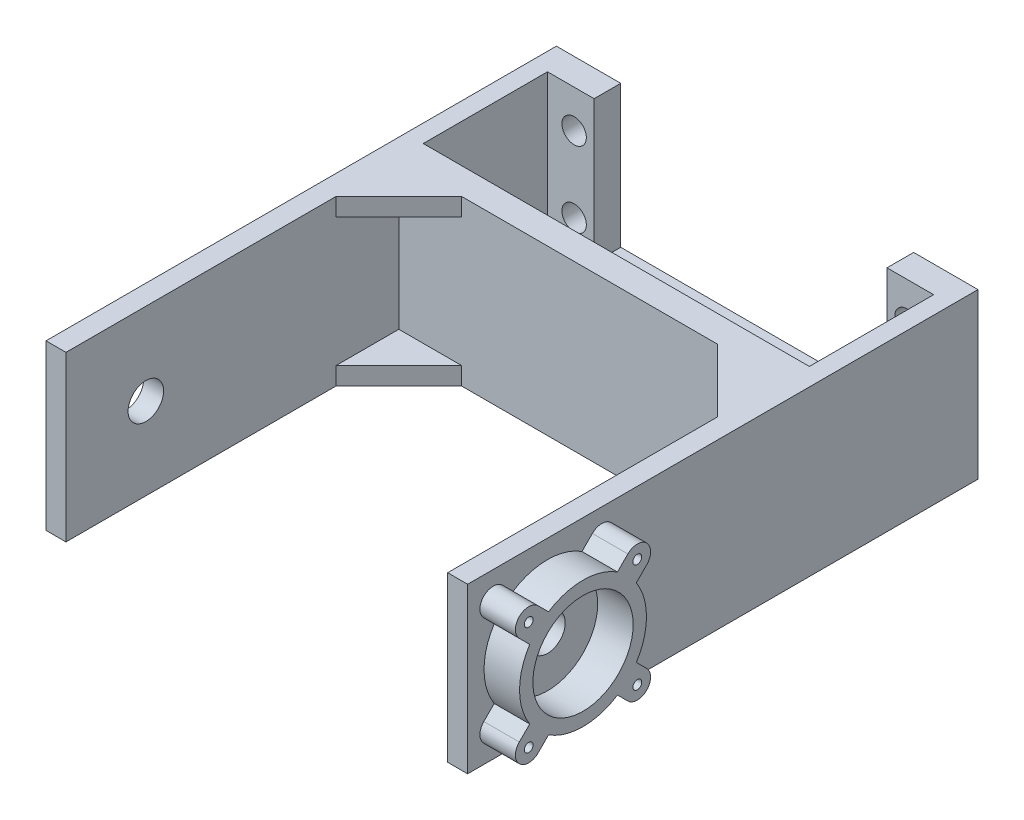
from build123d import *

# Parameters (mm, degrees)
SKETCH1_W            = 95
SKETCH1_H            = 40
BOSS_EXTRUDE1_DEPTH  = 5
SKETCH2_W            = 14.5
SKETCH2_H            = 6
BOSS_EXTRUDE2_DEPTH  = 32
SKETCH4_R            = 2.75
CUT_EXTRUDE1_DEPTH   = 6
BOSS_EXTRUDE5_DEPTH  = 32
SKETCH11_W           = 4.5
SKETCH11_H           = 37
BOSS_EXTRUDE6_DEPTH  = 75
SKETCH12_R           = 4
CUT_EXTRUDE3_DEPTH   = 110
BOSS_EXTRUDE9_DEPTH  = 4
SKETCH16_R           = 11.3
SKETCH16_R_2         = 1
BOSS_EXTRUDE11_DEPTH = 8


with BuildPart() as part:
    # Sketch1 → Boss-Extrude1 (new body)
    with BuildSketch(Plane(origin=(0, 0, 0), x_dir=(1, 0, 0), z_dir=(0, 1, 0))):
        Rectangle(SKETCH1_W, SKETCH1_H)
    extrude(amount=BOSS_EXTRUDE1_DEPTH)

    # Sketch2 → Boss-Extrude2 (add)
    with BuildSketch(Plane(origin=(0, 5, 0), x_dir=(1, 0, 0), z_dir=(0, 1, 0))):
        with Locations((-40.25, 17)):
            Rectangle(SKETCH2_W, SKETCH2_H)
        with Locations((40.25, 17)):
            Rectangle(SKETCH2_W, SKETCH2_H)
    extrude(amount=BOSS_EXTRUDE2_DEPTH)

    # Sketch4 → Cut-Extrude1 (cut)
    with BuildSketch(Plane(origin=(0, 0, -20), x_dir=(-1, 0, 0), z_dir=(0, 0, -1))):
        with Locations((37.5, 11.5)):
            Circle(SKETCH4_R)
        with Locations((37.5, 28.5)):
            Circle(SKETCH4_R)
        with Locations(Location((-37.5, 28.5, 0), (0, 0, 180))):
            Circle(SKETCH4_R)
        with Locations(Location((-37.5, 11.5, 0), (0, 0, 180))):
            Circle(SKETCH4_R)
    extrude(amount=-CUT_EXTRUDE1_DEPTH, mode=Mode.SUBTRACT)

    # Sketch10 → Boss-Extrude5 (add)
    with BuildSketch(Plane(origin=(0, 5, 0), x_dir=(1, 0, 0), z_dir=(0, 1, 0))):
        Polygon((-47.5, -14), (-47.5, -20), (-43.5, -20), (43.5, -20), (47.5, -20), (47.5, -19), (47.5, 14), (43.5, 14), (43.5, -14), (-43.5, -14), (-43.5, 14), (-47.5, 14), align=None)
    extrude(amount=BOSS_EXTRUDE5_DEPTH)

    # Sketch11 → Boss-Extrude6 (add)
    with BuildSketch(Plane.XY.offset(20)):
        with Locations((-45.25, 18.5)):
            Rectangle(SKETCH11_W, SKETCH11_H)
        with Locations((45.25, 18.5)):
            Rectangle(SKETCH11_W, SKETCH11_H)
    extrude(amount=BOSS_EXTRUDE6_DEPTH)

    # Sketch12 → Cut-Extrude3 (cut)
    with BuildSketch(Plane.ZY.offset(47.5)):
        with Locations((77, 18.5)):
            Circle(SKETCH12_R)
    extrude(amount=-CUT_EXTRUDE3_DEPTH, mode=Mode.SUBTRACT)

    # Sketch15 → Boss-Extrude9 (add)
    with BuildSketch(Plane(origin=(0, 37, 0), x_dir=(1, 0, 0), z_dir=(0, 1, 0))):
        Polygon((28.857864376, -20), (43, -34.142135624), (43, -20), align=None)
        Polygon((-28.857864376, -20), (-43, -20), (-43, -34.142135624), align=None)
    boss_extrude9 = extrude(amount=-BOSS_EXTRUDE9_DEPTH)

    # Mirror2: Boss-Extrude9 across plane
    add(boss_extrude9.mirror(Plane.ZX.offset(18.5)))

    # Sketch16 → Boss-Extrude11 (add)
    with BuildSketch(Plane(origin=(47.5, 0, 0), x_dir=(0, 0, -1), z_dir=(1, 0, 0))):
        with BuildLine():
            Line((-66.888373029, 4.145732342), (-69.234713241, 6.492072554))
            ThreePointArc((-69.234713241, 6.492072554), (-77, 4.2), (-84.765286759, 6.492072554))
            Line((-84.765286759, 6.492072554), (-87.111626971, 4.145732342))
            ThreePointArc((-87.111626971, 4.145732342), (-91.354267658, 4.145732342), (-91.354267658, 8.388373029))
            Line((-91.354267658, 8.388373029), (-89.007927446, 10.734713241))
            ThreePointArc((-89.007927446, 10.734713241), (-91.3, 18.5), (-89.007927446, 26.265286759))
            Line((-89.007927446, 26.265286759), (-91.354267658, 28.611626971))
            ThreePointArc((-91.354267658, 28.611626971), (-91.354267658, 32.854267658), (-87.111626971, 32.854267658))
            Line((-87.111626971, 32.854267658), (-84.765286759, 30.507927446))
            ThreePointArc((-84.765286759, 30.507927446), (-77, 32.8), (-69.234713241, 30.507927446))
            Line((-69.234713241, 30.507927446), (-66.888373029, 32.854267658))
            ThreePointArc((-66.888373029, 32.854267658), (-62.645732342, 32.854267658), (-62.645732342, 28.611626971))
            Line((-62.645732342, 28.611626971), (-64.992072554, 26.265286759))
            ThreePointArc((-64.992072554, 26.265286759), (-62.7, 18.5), (-64.992072554, 10.734713241))
            Line((-64.992072554, 10.734713241), (-62.645732342, 8.388373029))
            ThreePointArc((-62.645732342, 8.388373029), (-62.645732342, 4.145732342), (-66.888373029, 4.145732342))
        make_face()
        with Locations((-77, 18.5)):
            Circle(SKETCH16_R, mode=Mode.SUBTRACT)
        with Locations((-64.767052685, 6.267052685)):
            Circle(SKETCH16_R_2, mode=Mode.SUBTRACT)
        with Locations((-89.232947315, 6.267052685)):
            Circle(SKETCH16_R_2, mode=Mode.SUBTRACT)
        with Locations((-89.232947315, 30.732947315)):
            Circle(SKETCH16_R_2, mode=Mode.SUBTRACT)
        with Locations((-64.767052685, 30.732947315)):
            Circle(SKETCH16_R_2, mode=Mode.SUBTRACT)
    extrude(amount=BOSS_EXTRUDE11_DEPTH)


solid = part.part
